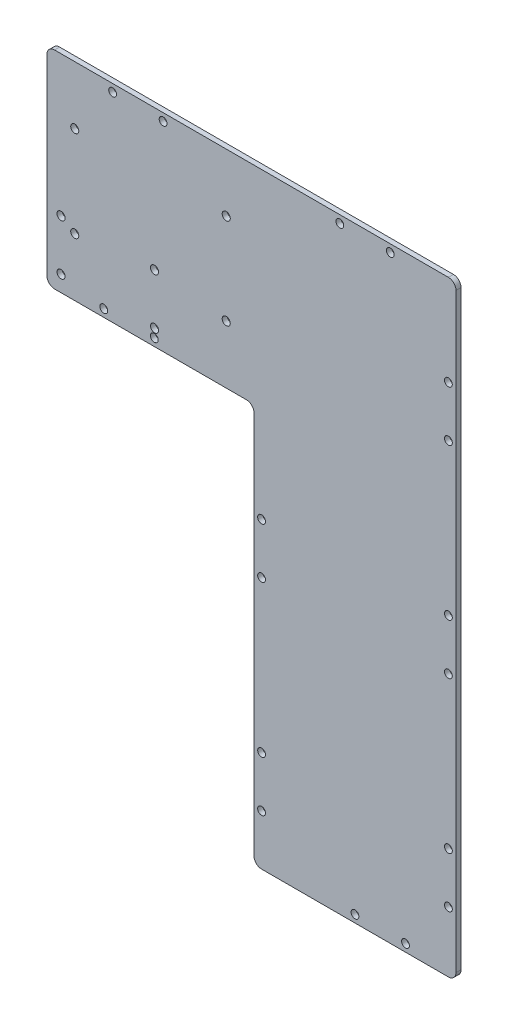
from build123d import *

# Parameters (mm, degrees)
SKETCH_1_W          = 82
SKETCH_1_H          = 82
EXTRUDE_1_DEPTH     = 2
SKETCH_2_R          = 1.55
SKETCH_2_R_2        = 1.6
CUT_EXTRUDE_1_DEPTH = 233.907707043
FILLET_1_R          = 3
SKETCH_4_R          = 1.6
CUT_EXTRUDE_2_DEPTH = 233.907707043


with BuildPart() as part:
    # 草图1 → 凸台-拉伸1 (new body)
    with BuildSketch(Plane.XY):
        Rectangle(SKETCH_1_W, SKETCH_1_H)
        Polygon((121, 41), (41, 41), (41, -41), (41, -199), (121, -199), align=None)
    extrude(amount=EXTRUDE_1_DEPTH)

    # 草图2 → 切除-拉伸1 (cut, through all)
    with BuildSketch(Plane.XY.offset(2)):
        with Locations((-15, 38)):
            Circle(SKETCH_2_R)
        with Locations((5, 38)):
            Circle(SKETCH_2_R)
        with Locations((-18.5, -38)):
            Circle(SKETCH_2_R)
        with Locations((1.5, -38)):
            Circle(SKETCH_2_R)
        with Locations((-30, 18)):
            Circle(SKETCH_2_R_2)
        with Locations((30, 18)):
            Circle(SKETCH_2_R_2)
        with Locations((30, -18)):
            Circle(SKETCH_2_R_2)
        with Locations((-30, -18)):
            Circle(SKETCH_2_R_2)
        with Locations((44, -179)):
            Circle(SKETCH_2_R)
        with Locations((44, -159)):
            Circle(SKETCH_2_R)
        with Locations((101, -196)):
            Circle(SKETCH_2_R)
        with Locations((81, -196)):
            Circle(SKETCH_2_R)
        with Locations((44, -99)):
            Circle(SKETCH_2_R)
        with Locations((44, -79)):
            Circle(SKETCH_2_R)
        with Locations((118, 5)):
            Circle(SKETCH_2_R)
        with Locations((118, -15)):
            Circle(SKETCH_2_R)
        with Locations((118, -75)):
            Circle(SKETCH_2_R)
        with Locations((118, -95)):
            Circle(SKETCH_2_R)
        with Locations((118, -175)):
            Circle(SKETCH_2_R)
        with Locations((118, -155)):
            Circle(SKETCH_2_R)
        with Locations((95, 38)):
            Circle(SKETCH_2_R)
        with Locations((75, 38)):
            Circle(SKETCH_2_R)
    extrude(amount=-CUT_EXTRUDE_1_DEPTH, mode=Mode.SUBTRACT)

    # 圆角1
    fillet_1_edges = [part.edges().sort_by_distance(p)[0] for p in [
        (-41, -41, 1),
        (-41, 41, 1),
        (121, 41, 1),
        (121, -199, 1),
        (41, -199, 1),
        (41, -41, 1),
    ]]
    fillet(fillet_1_edges, radius=FILLET_1_R)

    # 草图4 → 切除-拉伸2 (cut, through all)
    with BuildSketch(Plane.XY.offset(2)):
        with Locations((-35.434500029, -34.624495654)):
            Circle(SKETCH_4_R)
        with Locations((1.595499971, -34.624495654)):
            Circle(SKETCH_4_R)
        with Locations((1.595499971, -14.624495654)):
            Circle(SKETCH_4_R)
        with Locations((-35.434500029, -14.624495654)):
            Circle(SKETCH_4_R)
    extrude(amount=-CUT_EXTRUDE_2_DEPTH, mode=Mode.SUBTRACT)


solid = part.part
